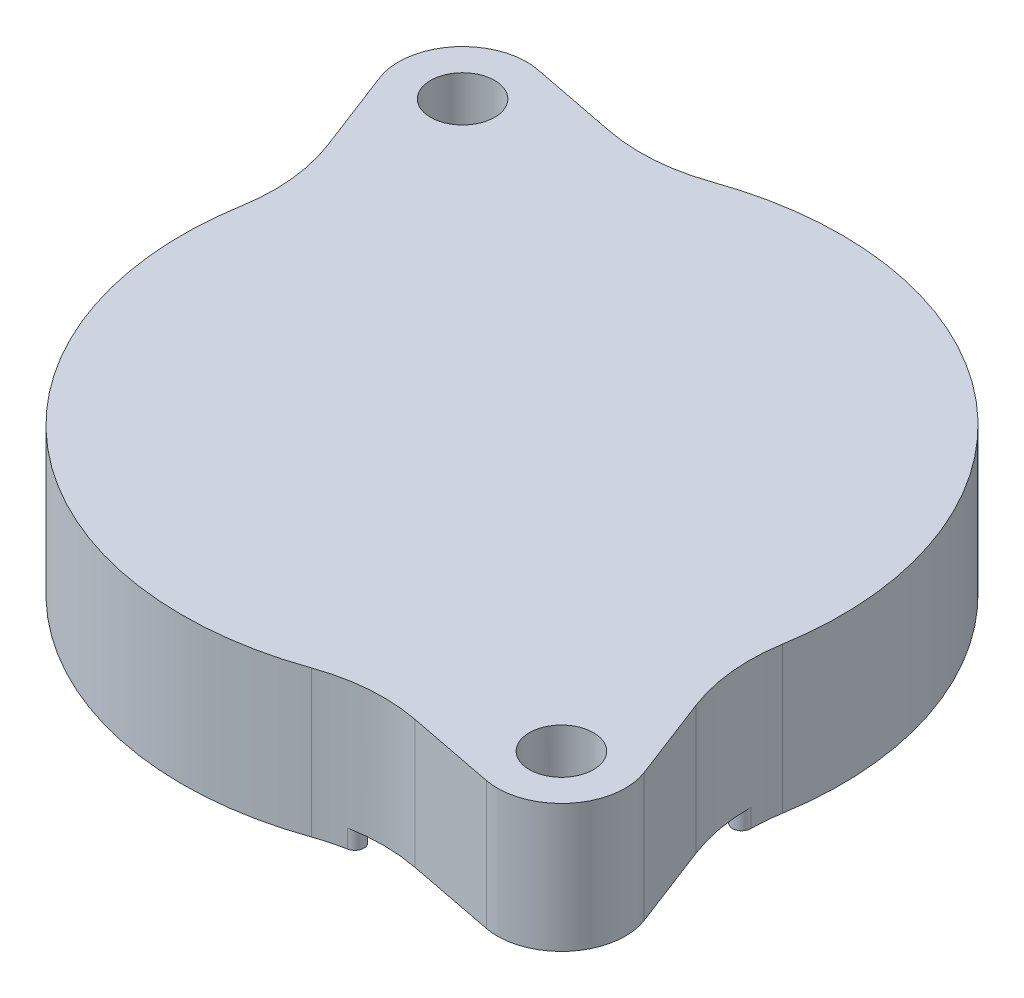
from build123d import *

# Parameters (mm, degrees)
BOSS_EXTRUDE1_DEPTH = 7
BOSS_EXTRUDE2_START = 1
BOSS_EXTRUDE2_DEPTH = 1
SKETCH3_R           = 1.75
CUT_EXTRUDE1_DEPTH  = 29.268910739


with BuildPart() as part:
    # Sketch1 → Boss-Extrude1 (new body)
    with BuildSketch(Plane.XZ.offset(-0.5)):
        with BuildLine():
            Line((-18.277494739, -8.221105303), (-20.043904797, -12.822760829))
            ThreePointArc((-20.043904797, -12.822760829), (-19.457528855, -16.326805286), (-16.10854182, -17.512743794))
            Line((-16.10854182, -17.512743794), (-11.270061894, -16.57223857))
            ThreePointArc((-11.270061894, -16.57223857), (-8.617981259, -16.416224916), (-6.018410533, -16.964042403))
            ThreePointArc((-6.018410533, -16.964042403), (11.570176974, -13.788799976), (17.751406503, 2.981202305))
            ThreePointArc((17.751406503, 2.981202305), (17.663322313, 5.636407218), (18.277494739, 8.221105303))
            Line((18.277494739, 8.221105303), (20.043904797, 12.822760829))
            ThreePointArc((20.043904797, 12.822760829), (19.457528855, 16.326805286), (16.10854182, 17.512743794))
            Line((16.10854182, 17.512743794), (11.270061894, 16.57223857))
            ThreePointArc((11.270061894, 16.57223857), (8.617981259, 16.416224916), (6.018410533, 16.964042403))
            ThreePointArc((6.018410533, 16.964042403), (-11.570176974, 13.788799976), (-17.751406503, -2.981202305))
            ThreePointArc((-17.751406503, -2.981202305), (-17.663322313, -5.636407218), (-18.277494739, -8.221105303))
        make_face()
    extrude(amount=-BOSS_EXTRUDE1_DEPTH)

    # Sketch2 → Boss-Extrude2 (add)
    with BuildSketch(Plane.XZ.offset(-0.5).offset(BOSS_EXTRUDE2_START)):
        with BuildLine():
            Line((-7.793099068, -15.677037579), (-7.400434194, -15.347552628))
            ThreePointArc((-7.400434194, -15.347552628), (-7.14763906, -15.235302983), (-6.873851261, -15.274617153))
            ThreePointArc((-6.873851261, -15.274617153), (10.766716645, -12.831273242), (16.236193142, 4.117012581))
            ThreePointArc((16.236193142, 4.117012581), (16.245018994, 4.393467763), (16.39946073, 4.622930425))
            Line((16.39946073, 4.622930425), (16.792125603, 4.952415375))
            ThreePointArc((16.792125603, 4.952415375), (17.323359362, 5.02322924), (17.613508913, 4.572632804))
            ThreePointArc((17.613508913, 4.572632804), (17.650630104, 3.77415969), (17.751406503, 2.981202305))
            ThreePointArc((17.751406503, 2.981202305), (11.570176974, -13.788799976), (-6.018410533, -16.964042403))
            ThreePointArc((-6.018410533, -16.964042403), (-6.781821476, -16.72710142), (-7.561717962, -16.551890782))
            ThreePointArc((-7.561717962, -16.551890782), (-7.955084885, -16.187904005), (-7.793099068, -15.677037579))
        make_face()
        with BuildLine():
            Line((7.793099068, 15.677037579), (7.400434194, 15.347552628))
            ThreePointArc((7.400434194, 15.347552628), (7.14763906, 15.235302983), (6.873851261, 15.274617153))
            ThreePointArc((6.873851261, 15.274617153), (-10.766716645, 12.831273242), (-16.236193142, -4.117012581))
            ThreePointArc((-16.236193142, -4.117012581), (-16.245018994, -4.393467763), (-16.39946073, -4.622930425))
            Line((-16.39946073, -4.622930425), (-16.792125603, -4.952415375))
            ThreePointArc((-16.792125603, -4.952415375), (-17.323359362, -5.02322924), (-17.613508913, -4.572632804))
            ThreePointArc((-17.613508913, -4.572632804), (-17.650630104, -3.77415969), (-17.751406503, -2.981202305))
            ThreePointArc((-17.751406503, -2.981202305), (-11.570176974, 13.788799976), (6.018410533, 16.964042403))
            ThreePointArc((6.018410533, 16.964042403), (6.781821476, 16.72710142), (7.561717962, 16.551890782))
            ThreePointArc((7.561717962, 16.551890782), (7.955084885, 16.187904005), (7.793099068, 15.677037579))
        make_face()
    extrude(amount=-BOSS_EXTRUDE2_DEPTH)

    # Sketch3 → Cut-Extrude1 (cut, through all)
    with BuildSketch(Plane(origin=(0, 7.5, 0), x_dir=(-1, 0, 0), z_dir=(0, 1, 0))):
        with Locations(Location((-16.776373304, 14.077048652, 0), (0, 0, 90))):
            Circle(SKETCH3_R)
        with Locations(Location((16.776373304, -14.077048652, 0), (0, 0, 90))):
            Circle(SKETCH3_R)
    extrude(amount=-CUT_EXTRUDE1_DEPTH, mode=Mode.SUBTRACT)


solid = part.part
